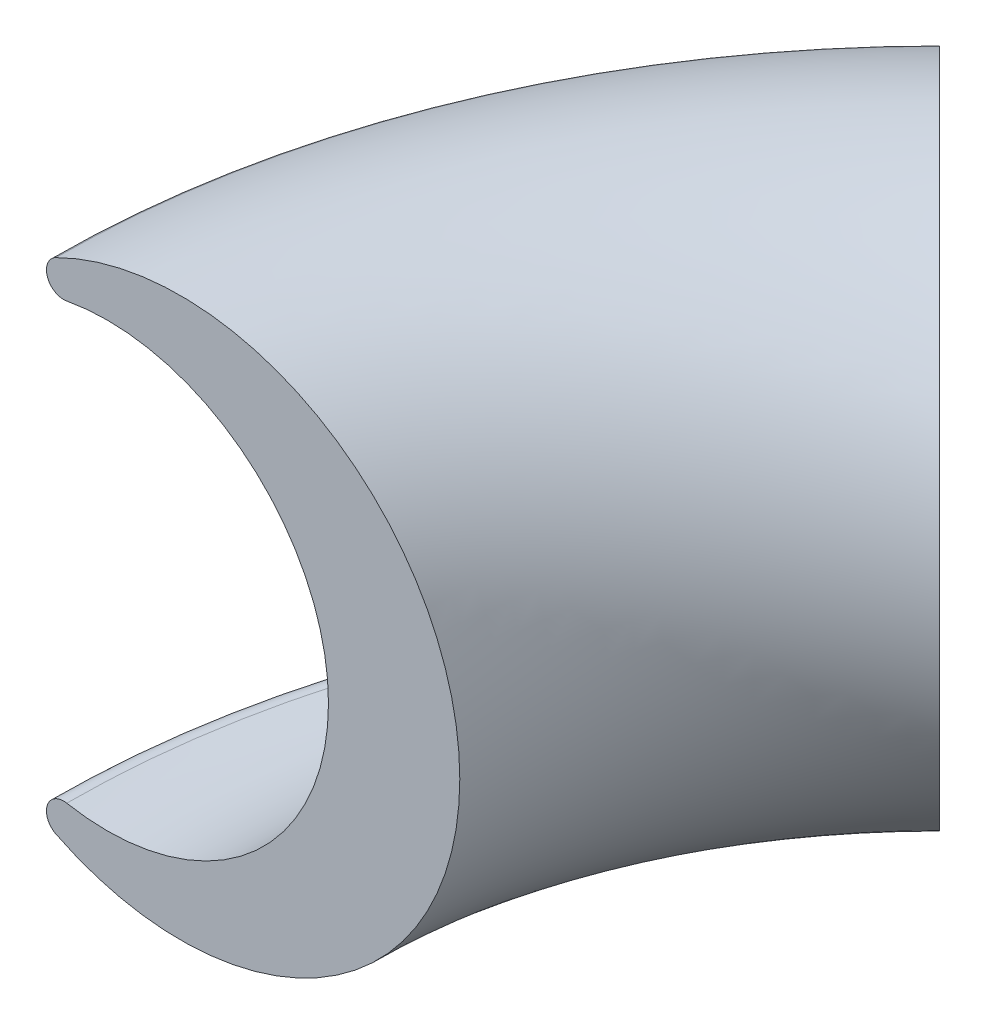
from build123d import *

# Parameters (mm, degrees)
FILLET1_R = 0.4445


with BuildPart() as part:
    # Sweep1: sweep along a path in Sketch1
    with BuildLine(Plane(origin=(0, 0, 0), x_dir=(1, 0, 0), z_dir=(0, 1, 0))) as sweep1_path:
        ThreePointArc((5.588, 0), (7.231440893, 8.262135305), (11.911564594, 15.266435406))
    # Sketch2 → Sweep1 (sweep)
    with BuildSketch(Plane.XY):
        with BuildLine():
            ThreePointArc((11.326, 0), (7.714353036, 5.329471528), (1.425941872, 3.949926093))
            ThreePointArc((1.425941872, 3.949926093), (14.732551814, 0), (1.425941872, -3.949926093))
            ThreePointArc((1.425941872, -3.949926093), (7.714353036, -5.329471528), (11.326, 0))
        make_face()
    sweep(path=sweep1_path.line)

    # Fillet1
    fillet1_edges = [part.edges().sort_by_distance(p)[0] for p in [
        (3.386200576, 3.949926093, -9.854885995),
        (3.386200576, -3.949926093, -9.854885995),
    ]]
    fillet(fillet1_edges, radius=FILLET1_R)


solid = part.part
